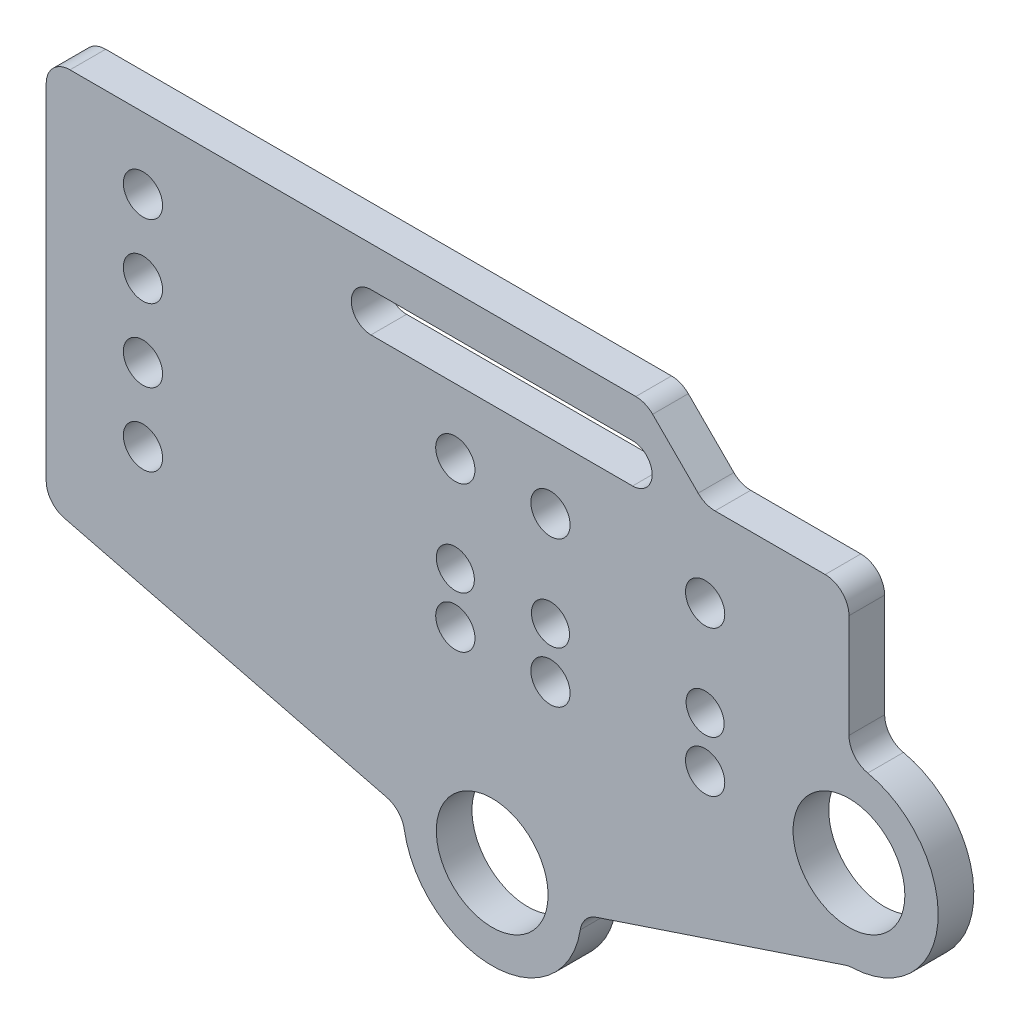
from build123d import *

# Parameters (mm, degrees)
SKETCH_1_R          = 1.65
SKETCH_1_R_2        = 4.7
EXTRUDE_1_DEPTH     = 3
FILLET_4_R          = 2
CUT_EXTRUDE_2_DEPTH = 10
SKETCH_3_R          = 1.6
CUT_EXTRUDE_4_DEPTH = 10


with BuildPart() as part:
    # 草图1 → 凸台-拉伸1 (new body)
    with BuildSketch(Plane.XY):
        with BuildLine():
            Line((55.40625, 35), (50.40625, 40))
            Line((50.40625, 40), (0, 40))
            Line((0, 40), (0, 7.5))
            Line((0, 7.5), (30, 0))
            ThreePointArc((30, 0), (37.5, -7.5), (45, 0))
            Line((45, 0), (67.5, 7.5))
            ThreePointArc((67.5, 7.5), (75, 15), (67.5, 22.5))
            Line((67.5, 22.5), (67.5, 35))
            Line((67.5, 35), (55.40625, 35))
        make_face()
        with Locations((8.136085868, 34)):
            Circle(SKETCH_1_R, mode=Mode.SUBTRACT)
        with Locations((42.401142919, 27.875)):
            Circle(SKETCH_1_R, mode=Mode.SUBTRACT)
        with Locations((34.401142919, 27.875)):
            Circle(SKETCH_1_R, mode=Mode.SUBTRACT)
        with Locations((55.40625, 27.875)):
            Circle(SKETCH_1_R, mode=Mode.SUBTRACT)
        with Locations((8.136085868, 15.625)):
            Circle(SKETCH_1_R, mode=Mode.SUBTRACT)
        with Locations((34.401142919, 15.625)):
            Circle(SKETCH_1_R, mode=Mode.SUBTRACT)
        with Locations((42.401142919, 15.625)):
            Circle(SKETCH_1_R, mode=Mode.SUBTRACT)
        with Locations((55.40625, 15.625)):
            Circle(SKETCH_1_R, mode=Mode.SUBTRACT)
        with Locations((8.136085868, 21.75)):
            Circle(SKETCH_1_R, mode=Mode.SUBTRACT)
        with Locations((8.136085868, 27.875)):
            Circle(SKETCH_1_R, mode=Mode.SUBTRACT)
        with Locations((37.5, 0)):
            Circle(SKETCH_1_R_2, mode=Mode.SUBTRACT)
        with Locations((67.5, 15)):
            Circle(SKETCH_1_R_2, mode=Mode.SUBTRACT)
    extrude(amount=EXTRUDE_1_DEPTH)

    # 圆角4
    fillet_4_edges = [part.edges().sort_by_distance(p)[0] for p in [
        (55.40625, 35, 1.5),
        (67.5, 35, 1.5),
        (67.5, 22.5, 1.5),
        (67.5, 7.5, 1.5),
        (45, 0, 1.5),
        (30, 0, 1.5),
        (0, 7.5, 1.5),
        (0, 40, 1.5),
        (50.40625, 40, 1.5),
    ]]
    fillet(fillet_4_edges, radius=FILLET_4_R)

    # 草图2 → 切除-拉伸2 (cut)
    with BuildSketch(Plane.XY):
        with BuildLine():
            Line((49.30341073, 36.65), (27.30341073, 36.65))
            ThreePointArc((27.30341073, 36.65), (25.65341073, 35), (27.30341073, 33.35))
            Line((27.30341073, 33.35), (49.30341073, 33.35))
            ThreePointArc((49.30341073, 33.35), (50.95341073, 35), (49.30341073, 36.65))
        make_face()
    extrude(amount=CUT_EXTRUDE_2_DEPTH, mode=Mode.SUBTRACT)

    # 草图3 → 切除-拉伸4 (cut)
    with BuildSketch(Plane.XY):
        with BuildLine():
            ThreePointArc((36.001142919, 19.875), (35.532513769, 21.00637085), (34.401142919, 21.475))
            Line((34.401142919, 21.475), (34.401142919, 19.875))
            Line((34.401142919, 19.875), (36.001142919, 19.875))
        make_face()
        with BuildLine():
            Line((34.401142919, 19.875), (34.401142919, 21.475))
            ThreePointArc((34.401142919, 21.475), (33.269772069, 18.74362915), (36.001142919, 19.875))
            Line((36.001142919, 19.875), (34.401142919, 19.875))
        make_face()
        with BuildLine():
            ThreePointArc((44.001142919, 19.875), (43.532513769, 21.00637085), (42.401142919, 21.475))
            Line((42.401142919, 21.475), (42.401142919, 19.875))
            Line((42.401142919, 19.875), (40.801142919, 19.875))
            ThreePointArc((40.801142919, 19.875), (42.401142919, 18.275), (44.001142919, 19.875))
        make_face()
        with BuildLine():
            Line((42.401142919, 19.875), (42.401142919, 21.475))
            ThreePointArc((42.401142919, 21.475), (41.269772069, 21.00637085), (40.801142919, 19.875))
            Line((40.801142919, 19.875), (42.401142919, 19.875))
        make_face()
        with Locations((55.40625, 19.875)):
            Circle(SKETCH_3_R)
    extrude(amount=CUT_EXTRUDE_4_DEPTH, mode=Mode.SUBTRACT)


solid = part.part
